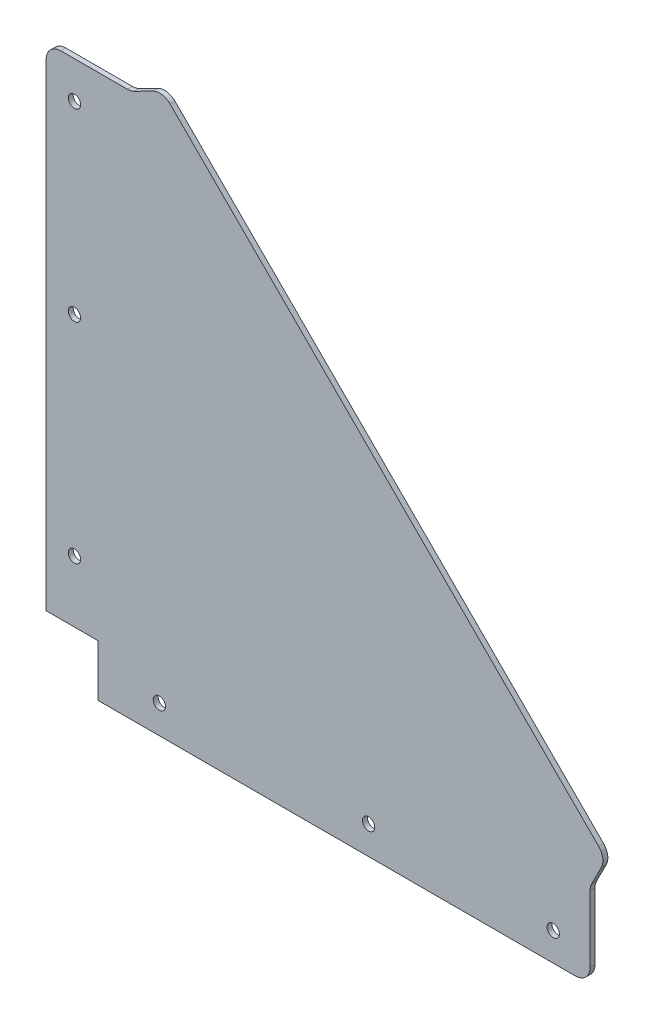
from build123d import *

# Parameters (mm, degrees)
SKETCH_1_R      = 2.5
EXTRUDE_1_DEPTH = 2
FILLET_1_R      = 6


with BuildPart() as part:
    # 草圖1 → 擠出1 (new body)
    with BuildSketch(Plane.XY):
        Polygon((21, 0), (21, 21), (0, 21), (0, 221), (34.5, 221), (47.301071766, 227.522471846), (227.522471846, 47.301071766), (222.528576348, 37.5), (221, 34.5), (221, 21), (221, 0), align=None)
        with Locations((11.5, 46)):
            Circle(SKETCH_1_R, mode=Mode.SUBTRACT)
        with Locations((11.5, 131)):
            Circle(SKETCH_1_R, mode=Mode.SUBTRACT)
        with Locations((11.5, 206)):
            Circle(SKETCH_1_R, mode=Mode.SUBTRACT)
        with Locations((46, 11.5)):
            Circle(SKETCH_1_R, mode=Mode.SUBTRACT)
        with Locations((131, 11.5)):
            Circle(SKETCH_1_R, mode=Mode.SUBTRACT)
        with Locations((206, 11.5)):
            Circle(SKETCH_1_R, mode=Mode.SUBTRACT)
    extrude(amount=EXTRUDE_1_DEPTH)

    # 圓角1
    fillet_1_edges = [part.edges().sort_by_distance(p)[0] for p in [
        (0, 221, 1),
        (34.5, 221, 1),
        (47.301071766, 227.522471846, 1),
        (227.522471846, 47.301071766, 1),
        (221, 34.5, 1),
        (221, 0, 1),
    ]]
    fillet(fillet_1_edges, radius=FILLET_1_R)


solid = part.part
